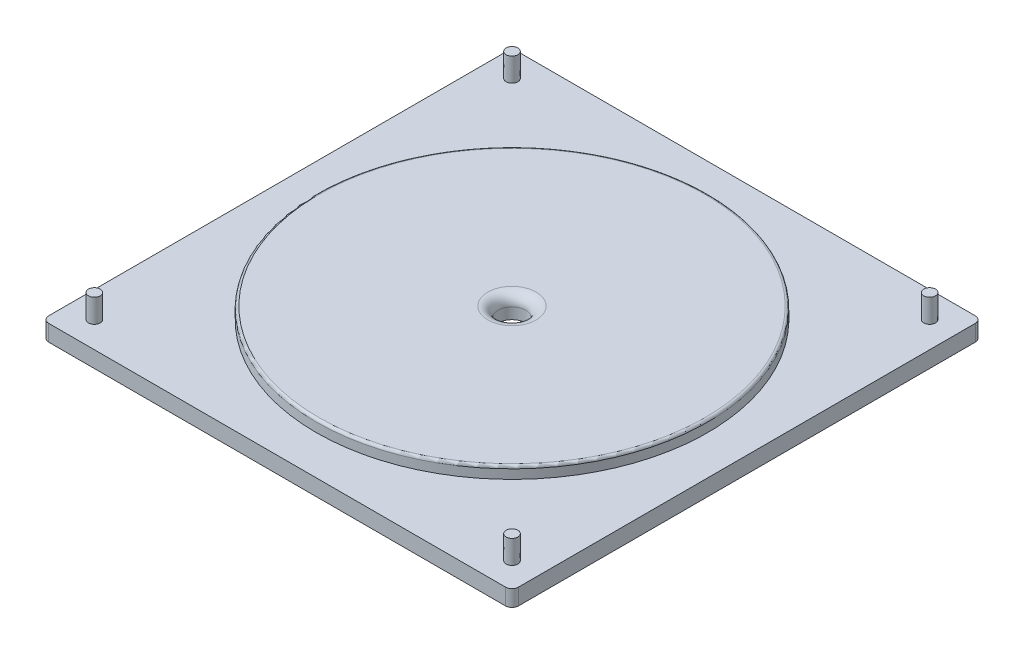
from build123d import *

# Parameters (mm, degrees)
SKETCH1_W           = 91.44
SKETCH1_H           = 91.44
BOSS_EXTRUDE1_DEPTH = 3.175
SKETCH2_R           = 38.1
BOSS_EXTRUDE2_DEPTH = 2.286
SKETCH3_R           = 1.143
BOSS_EXTRUDE3_DEPTH = 4.572
SKETCH4_R           = 2.667
CUT_EXTRUDE1_DEPTH  = 104.048504199
FILLET1_R           = 2.032
FILLET3_R           = 1.27
SKETCH5_R           = 20.32
CUT_EXTRUDE2_DEPTH  = 1.27
FILLET4_R           = 0.762
FILLET6_R           = 0.508


with BuildPart() as part:
    # Sketch1 → Boss-Extrude1 (new body)
    with BuildSketch(Plane(origin=(0, 0, 0), x_dir=(1, 0, 0), z_dir=(0, 1, 0))):
        with Locations((45.065298329, -2.727923628)):
            Rectangle(SKETCH1_W, SKETCH1_H)
    extrude(amount=BOSS_EXTRUDE1_DEPTH)

    # Sketch2 → Boss-Extrude2 (add)
    with BuildSketch(Plane(origin=(0, 3.175, 0), x_dir=(1, 0, 0), z_dir=(0, 1, 0))):
        with Locations(Location((45.065298329, -2.727923628, 0), (0, 0, 270))):
            Circle(SKETCH2_R)
    extrude(amount=BOSS_EXTRUDE2_DEPTH)

    # Sketch3 → Boss-Extrude3 (add)
    with BuildSketch(Plane(origin=(0, 3.175, 0), x_dir=(1, 0, 0), z_dir=(0, 1, 0))):
        with Locations(Location((4.425298329, 37.912076372, 0), (0, 0, 270))):
            Circle(SKETCH3_R)
        with Locations(Location((4.425298329, -43.367923628, 0), (0, 0, 270))):
            Circle(SKETCH3_R)
        with Locations(Location((85.705298329, -43.367923628, 0), (0, 0, 270))):
            Circle(SKETCH3_R)
        with Locations(Location((85.705298329, 37.912076372, 0), (0, 0, 270))):
            Circle(SKETCH3_R)
    extrude(amount=BOSS_EXTRUDE3_DEPTH)

    # Sketch4 → Cut-Extrude1 (cut, through all)
    with BuildSketch(Plane(origin=(0, 5.461, 0), x_dir=(1, 0, 0), z_dir=(0, 1, 0))):
        with Locations(Location((45.065298329, -2.727923628, 0), (0, 0, 270))):
            Circle(SKETCH4_R)
    extrude(amount=-CUT_EXTRUDE1_DEPTH, mode=Mode.SUBTRACT)

    # Fillet1
    fillet1_edges = [part.edges().sort_by_distance(p)[0] for p in [
        (45.065298329, 5.461, 0.060923628),
    ]]
    fillet(fillet1_edges, radius=FILLET1_R)

    # Fillet3
    fillet3_edges = [part.edges().sort_by_distance(p)[0] for p in [
        (-0.654701671, 1.5875, -42.992076372),
        (90.785298329, 1.5875, -42.992076372),
        (90.785298329, 1.5875, 48.447923628),
        (-0.654701671, 1.5875, 48.447923628),
    ]]
    fillet(fillet3_edges, radius=FILLET3_R)

    # Sketch5 → Cut-Extrude2 (cut)
    with BuildSketch(Plane.XZ):
        with Locations(Location((45.065298329, 2.727923628, 0), (0, 0, 270))):
            Circle(SKETCH5_R)
    extrude(amount=-CUT_EXTRUDE2_DEPTH, mode=Mode.SUBTRACT)

    # Fillet4
    fillet4_edges = [part.edges().sort_by_distance(p)[0] for p in [
        (45.065298329, 0, 23.047923628),
    ]]
    fillet(fillet4_edges, radius=FILLET4_R)

    # Fillet6
    fillet6_edges = [part.edges().sort_by_distance(p)[0] for p in [
        (45.065298329, 5.461, -35.372076372),
    ]]
    fillet(fillet6_edges, radius=FILLET6_R)


solid = part.part
